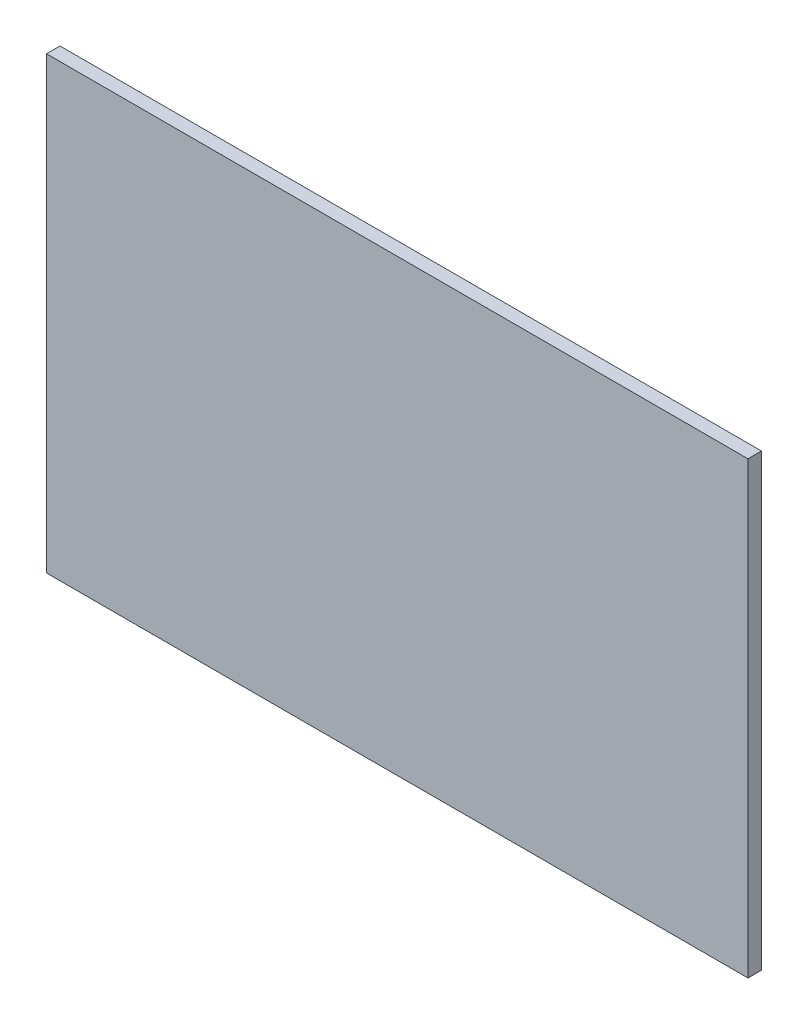
from build123d import *

# Parameters (mm, degrees)
ESQUISSE1_W        = 156
ESQUISSE1_H        = 100
BOSS_EXTRU_1_DEPTH = 3


with BuildPart() as part:
    # Esquisse1 → Boss.-Extru.1 (new body)
    with BuildSketch(Plane.XY):
        Rectangle(ESQUISSE1_W, ESQUISSE1_H)
    extrude(amount=BOSS_EXTRU_1_DEPTH)


solid = part.part
